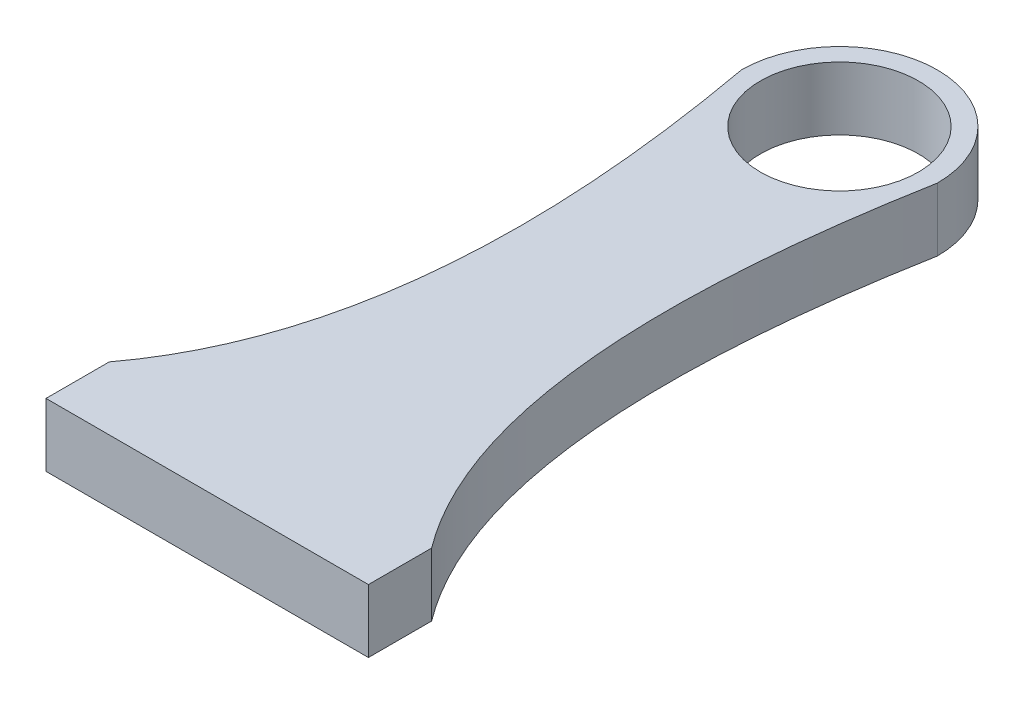
from build123d import *

# Parameters (mm, degrees)
SKETCH_1_R          = 12.5
EXTRUDE_1_DEPTH     = 10
SKETCH_2_W          = 51
SKETCH_2_H          = 10
EXTRUDE_2_DEPTH     = 10
EXTRUDE_3_DEPTH     = 10
CUT_EXTRUDE_2_DEPTH = 10


with BuildPart() as part:
    # Эскиз1 → Бобышка-Вытянуть1 (new body)
    with BuildSketch(Plane(origin=(0, 0, 0), x_dir=(1, 0, 0), z_dir=(0, 1, 0))):
        with BuildLine():
            Line((-15.5, 0), (-15.5, -100))
            Line((-15.5, -100), (15.5, -100))
            Line((15.5, -100), (15.5, 0))
            ThreePointArc((15.5, 0), (0, 15.5), (-15.5, 0))
        make_face()
        with Locations(Location((0, 0, 0), (0, 0, 270))):
            Circle(SKETCH_1_R, mode=Mode.SUBTRACT)
    extrude(amount=EXTRUDE_1_DEPTH)

    # Эскиз2 → Бобышка-Вытянуть2 (add, through all)
    with BuildSketch(Plane(origin=(0, 10, 0), x_dir=(1, 0, 0), z_dir=(0, 1, 0))):
        with Locations((0, -95)):
            Rectangle(SKETCH_2_W, SKETCH_2_H)
    extrude(amount=-EXTRUDE_2_DEPTH)

    # Эскиз4 → Бобышка-Вытянуть3 (add)
    with BuildSketch(Plane(origin=(0, 10, 0), x_dir=(1, 0, 0), z_dir=(0, 1, 0))):
        Polygon((-25.5, -90), (-15.5, 0), (-15.5, -90), align=None)
        Polygon((15.5, -90), (25.5, -90), (15.5, 0), align=None)
    extrude(amount=-EXTRUDE_3_DEPTH)

    # Эскиз3 → Вырез-Вытянуть2 (cut)
    with BuildSketch(Plane(origin=(0, 10, 0), x_dir=(1, 0, 0), z_dir=(0, 1, 0))):
        with BuildLine():
            Line((-15.5, 0), (-25.5, -90))
            add(Edge.make_bspline(
                [(-15.5, 0), (-4.236810468, -61.646447202), (-25.5, -90)],
                knots=[0, 0, 0, 1, 1, 1], degree=2))
        make_face()
        with BuildLine():
            Line((15.5, 0), (25.5, -90))
            add(Edge.make_bspline(
                [(15.5, 0), (4.236810468, -61.646447202), (25.5, -90)],
                knots=[0, 0, 0, 1, 1, 1], degree=2))
        make_face()
    extrude(amount=-CUT_EXTRUDE_2_DEPTH, mode=Mode.SUBTRACT)


solid = part.part
